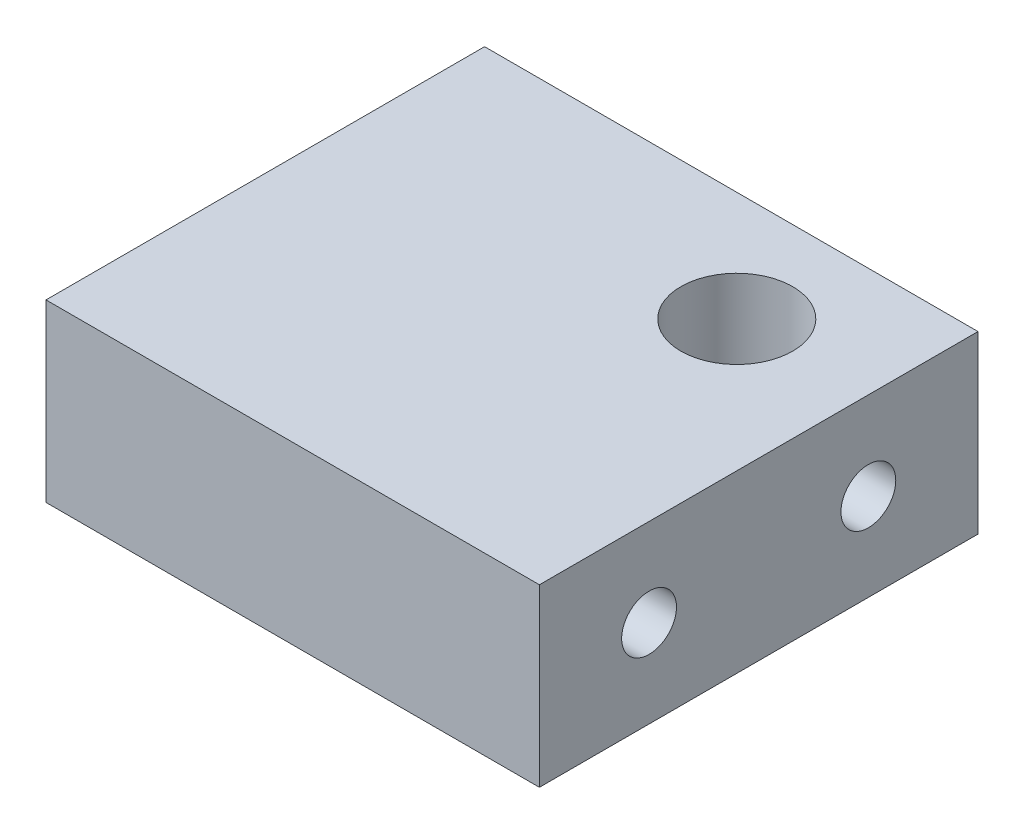
from build123d import *

# Parameters (mm, degrees)
SKETCH_1_W             = 45
SKETCH_1_H             = 40
EXTRUDE_1_DEPTH        = 16
HOLE_WIZARD_M6_1_D     = 5
SKETCH_5_R             = 5.1
CUT_EXTRUDE_1_DEPTH    = 50
HOLE_WIZARD_M6_2_D     = 5
HOLE_WIZARD_M6_2_DEPTH = 10
HOLE_WIZARD_M6_2_TIP   = 1.502151548


with BuildPart() as part:
    # 草图1 → 凸台-拉伸1 (new body)
    with BuildSketch(Plane(origin=(0, 0, 0), x_dir=(1, 0, 0), z_dir=(0, 1, 0))):
        Rectangle(SKETCH_1_W, SKETCH_1_H)
    extrude(amount=EXTRUDE_1_DEPTH)

    # M6 螺纹孔1 (through all)
    with Locations(Plane(origin=(22.5, 8, 10), x_dir=(0, 0, 1), z_dir=(1, 0, 0))):
        with Locations((0, 0)):
            Hole(HOLE_WIZARD_M6_1_D / 2)

    # 草图5 → 切除-拉伸1 (cut)
    with BuildSketch(Plane(origin=(0, 16, 0), x_dir=(1, 0, 0), z_dir=(0, 1, 0))):
        with Locations(Location((10.5, 10, 0), (0, 0, 270))):
            Circle(SKETCH_5_R)
    extrude(amount=-CUT_EXTRUDE_1_DEPTH, mode=Mode.SUBTRACT)

    # M6 螺纹孔2
    with Locations(Plane(origin=(22.5, 8, -10), x_dir=(0, 0, 1), z_dir=(1, 0, 0))):
        with Locations((0, 0)):
            Hole(HOLE_WIZARD_M6_2_D / 2, depth=HOLE_WIZARD_M6_2_DEPTH)
            with Locations((0, 0, -(HOLE_WIZARD_M6_2_DEPTH + HOLE_WIZARD_M6_2_TIP / 2))):  # 118° drill point
                Cone(0, HOLE_WIZARD_M6_2_D / 2, HOLE_WIZARD_M6_2_TIP, mode=Mode.SUBTRACT)


solid = part.part
